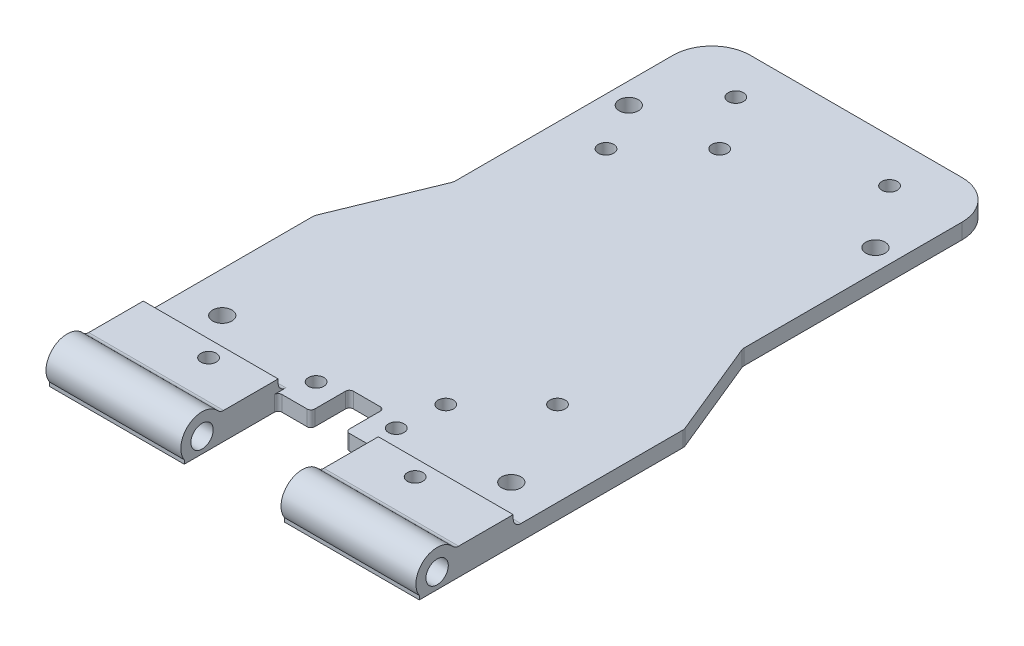
from build123d import *

# Parameters (mm, degrees)
BOSS_EXTRUDE1_DEPTH = 3
SKETCH5_W           = 35
SKETCH5_H           = 23
BOSS_EXTRUDE2_DEPTH = 3
BOSS_EXTRUDE5_DEPTH = 35
BOSS_EXTRUDE8_START = -35
BOSS_EXTRUDE8_DEPTH = 35
CUT_EXTRUDE1_START  = -96
SKETCH11_R          = 2.9
CUT_EXTRUDE1_DEPTH  = 96
BOSS_EXTRUDE7_DEPTH = 1
SKETCH17_R          = 2.5
CUT_EXTRUDE2_DEPTH  = 10
SKETCH18_R          = 2
CUT_EXTRUDE3_DEPTH  = 10
SKETCH19_R          = 2
CUT_EXTRUDE4_DEPTH  = 4
SKETCH21_R          = 2
CUT_EXTRUDE5_DEPTH  = 7
SKETCH22_R          = 2.5
CUT_EXTRUDE6_DEPTH  = 4
FILLET1_R           = 10
FILLET2_R           = 2
FILLET3_R           = 2
FILLET4_R           = 1


with BuildPart() as part:
    # Sketch1 → Boss-Extrude1 (new body)
    with BuildSketch(Plane(origin=(0, 0, 0), x_dir=(1, 0, 0), z_dir=(0, 1, 0))):
        Polygon((0, 0), (0, 23), (8.5, 23), (8.5, 33), (17.5, 33), (17.5, 23), (26, 23), (26, 0), (61, 0), (61, 28.801365462), (61, 67.406151765), (50.5, 93.029580251), (50.5, 160), (-24.5, 160), (-24.5, 93.029580251), (-35, 67.406151765), (-35, 28.801365462), (-35, 0), align=None)
    extrude(amount=BOSS_EXTRUDE1_DEPTH)

    # Sketch5 → Boss-Extrude2 (add)
    with BuildSketch(Plane(origin=(0, 3, 0), x_dir=(1, 0, 0), z_dir=(0, 1, 0))):
        with Locations((-17.5, 11.5)):
            Rectangle(SKETCH5_W, SKETCH5_H)
        with Locations((43.5, 11.5)):
            Rectangle(SKETCH5_W, SKETCH5_H)
    extrude(amount=BOSS_EXTRUDE2_DEPTH)

    # Sketch12 → Boss-Extrude5 (add)
    with BuildSketch(Plane.ZY.offset(35)):
        with BuildLine():
            Line((-7.857598958, 0), (1.361945499, 0))
            ThreePointArc((1.361945499, 0), (-3.247826729, 8.5), (-7.857598958, 0))
        make_face()
    extrude(amount=-BOSS_EXTRUDE5_DEPTH)

    # Sketch15 → Boss-Extrude8 (add)
    with BuildSketch(Plane(origin=(61, 0, 0), x_dir=(0, 0, -1), z_dir=(1, 0, 0)).offset(BOSS_EXTRUDE8_START)):
        with BuildLine():
            Line((7.857598958, 0), (-1.361945499, 0))
            ThreePointArc((-1.361945499, 0), (3.247826729, 8.5), (7.857598958, 0))
        make_face()
    extrude(amount=BOSS_EXTRUDE8_DEPTH)

    # Sketch11 → Cut-Extrude1 (cut)
    with BuildSketch(Plane.ZY.offset(35).offset(CUT_EXTRUDE1_START)):
        with Locations((-3.247826729, 3)):
            Circle(SKETCH11_R)
    extrude(amount=CUT_EXTRUDE1_DEPTH, mode=Mode.SUBTRACT)

    # Sketch14 → Boss-Extrude7 (add)
    with BuildSketch(Plane.XZ):
        Polygon((50.5, -93.029580251), (61, -67.406151765), (61, 1.361945499), (26, 1.361945499), (26, -23), (17.5, -23), (17.5, -33), (8.5, -33), (8.5, -23), (0, -23), (0, 1.361945499), (-35, 1.361945499), (-35, -67.406151765), (-24.5, -93.029580251), (-24.5, -160), (50.5, -160), align=None)
    extrude(amount=BOSS_EXTRUDE7_DEPTH)

    # Sketch17 → Cut-Extrude2 (cut)
    with BuildSketch(Plane(origin=(0, 3, 0), x_dir=(1, 0, 0), z_dir=(0, 1, 0))):
        with Locations(Location((-24.5, 33, 0), (0, 0, 270))):
            Circle(SKETCH17_R)
        with Locations(Location((50.5, 33, 0), (0, 0, 270))):
            Circle(SKETCH17_R)
    extrude(amount=-CUT_EXTRUDE2_DEPTH, mode=Mode.SUBTRACT)

    # Sketch18 → Cut-Extrude3 (cut)
    with BuildSketch(Plane(origin=(0, 3, 0), x_dir=(1, 0, 0), z_dir=(0, 1, 0))):
        with Locations(Location((-6.941705, 148.716738, 0), (0, 0, 270))):
            Circle(SKETCH18_R)
        with Locations(Location((32.941705, 148.716738, 0), (0, 0, 90))):
            Circle(SKETCH18_R)
    extrude(amount=-CUT_EXTRUDE3_DEPTH, mode=Mode.SUBTRACT)

    # Sketch19 → Cut-Extrude4 (cut)
    with BuildSketch(Plane(origin=(0, 3, 0), x_dir=(1, 0, 0), z_dir=(0, 1, 0))):
        with Locations(Location((-12.17438, 120.25, 0), (0, 0, 270))):
            Circle(SKETCH19_R)
        with Locations(Location((2.57562, 135, 0), (0, 0, 90))):
            Circle(SKETCH19_R)
        with Locations(Location((24.49992, 42, 0), (0, 0, 270))):
            Circle(SKETCH19_R)
        with Locations(Location((38.99992, 56.5, 0), (0, 0, 90))):
            Circle(SKETCH19_R)
    extrude(amount=-CUT_EXTRUDE4_DEPTH, mode=Mode.SUBTRACT)

    # Sketch21 → Cut-Extrude5 (cut)
    with BuildSketch(Plane(origin=(0, 6, 0), x_dir=(1, 0, 0), z_dir=(0, 1, 0))):
        with Locations(Location((-13.8, 18.7451, 0), (0, 0, 270))):
            Circle(SKETCH21_R)
        with Locations(Location((2.6, 30.245, 0), (0, 0, 270))):
            Circle(SKETCH21_R)
        with Locations(Location((23.4, 30.245, 0), (0, 0, 270))):
            Circle(SKETCH21_R)
        with Locations(Location((39.8, 18.7451, 0), (0, 0, 90))):
            Circle(SKETCH21_R)
    extrude(amount=-CUT_EXTRUDE5_DEPTH, mode=Mode.SUBTRACT)

    # Sketch22 → Cut-Extrude6 (cut)
    with BuildSketch(Plane(origin=(0, 3, 0), x_dir=(1, 0, 0), z_dir=(0, 1, 0))):
        with Locations(Location((-19, 133, 0), (0, 0, 270))):
            Circle(SKETCH22_R)
        with Locations(Location((45, 133, 0), (0, 0, 90))):
            Circle(SKETCH22_R)
    extrude(amount=-CUT_EXTRUDE6_DEPTH, mode=Mode.SUBTRACT)

    # Fillet1
    fillet1_edges = [part.edges().sort_by_distance(p)[0] for p in [
        (-24.5, 1, -160),
        (50.5, 1, -160),
    ]]
    fillet(fillet1_edges, radius=FILLET1_R)

    # Fillet2
    fillet2_edges = [part.edges().sort_by_distance(p)[0] for p in [
        (50.5, 1, -93.029580251),
        (61, 1, -67.406151765),
        (-17.5, 3, -23),
        (43.5, 3, -23),
        (-17.5, 6, -7.857598958),
        (43.5, 6, -7.857598958),
    ]]
    fillet(fillet2_edges, radius=FILLET2_R)

    # Fillet3
    fillet3_edges = [part.edges().sort_by_distance(p)[0] for p in [
        (-35, 1, -67.406151765),
        (-24.5, 1, -93.029580251),
    ]]
    fillet(fillet3_edges, radius=FILLET3_R)

    # Fillet4
    fillet4_edges = [part.edges().sort_by_distance(p)[0] for p in [
        (26, 1, -23),
        (17.5, 1, -23),
        (17.5, 1, -33),
        (8.5, 1, -33),
        (8.5, 1, -23),
        (0, 1, -23),
    ]]
    fillet(fillet4_edges, radius=FILLET4_R)


solid = part.part
